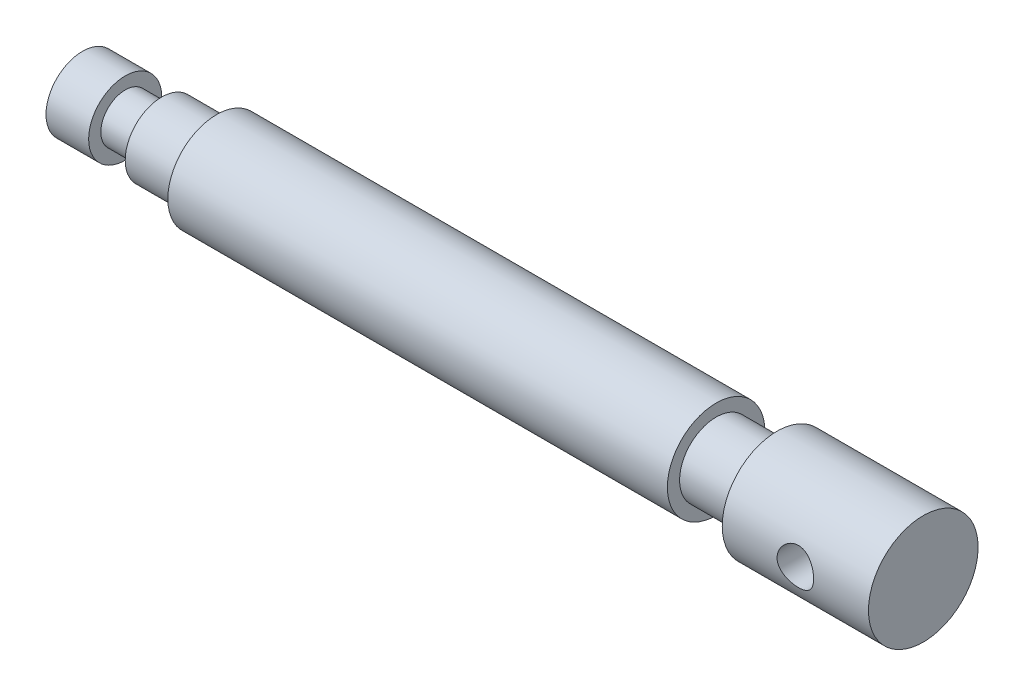
from build123d import *

# Parameters (mm, degrees)
SKETCH2_R          = 3
CUT_EXTRUDE1_DEPTH = 57


with BuildPart() as part:
    # Sketch1 → Revolve1 (revolve)
    with BuildSketch(Plane.XY, mode=Mode.PRIVATE) as revolve1_sk:
        Polygon((0, 0), (0, 6), (7, 6), (7, 4), (13, 4), (13, 6), (22, 6), (22, 8), (104, 8), (104, 6), (114, 6), (114, 9), (138, 9), (138, 0), align=None)
    revolve(revolve1_sk.sketch.rotate(Axis((0, 0, 0), (1, 0, 0)), 90), axis=Axis((0, 0, 0), (1, 0, 0)))

    # Sketch2 → Cut-Extrude1 (cut, symmetric)
    with BuildSketch(Plane.XY):
        with Locations((126, 0)):
            Circle(SKETCH2_R)
    extrude(amount=CUT_EXTRUDE1_DEPTH, both=True, mode=Mode.SUBTRACT)


solid = part.part
